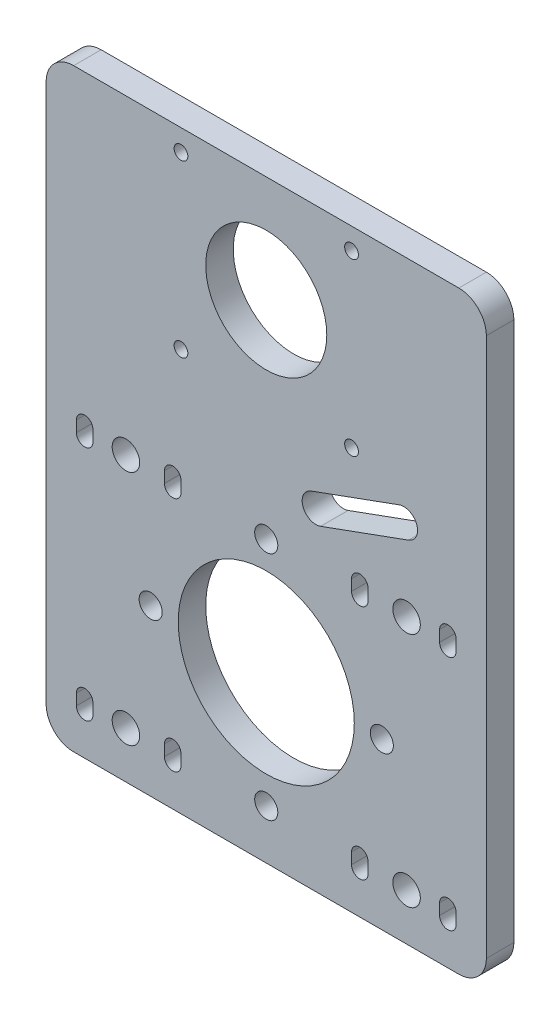
from build123d import *

# Parameters (mm, degrees)
SKETCH1_W           = 80
SKETCH1_H           = 108
SKETCH1_R           = 16
SKETCH1_R_2         = 11
SKETCH1_R_3         = 2.1
SKETCH1_R_4         = 1.25
SKETCH1_R_5         = 2.5
BOSS_EXTRUDE1_DEPTH = 2.5
FILLET1_R           = 5


with BuildPart() as part:
    # Sketch1 → Boss-Extrude1 (new, symmetric)
    with BuildSketch(Plane.XY):
        Rectangle(SKETCH1_W, SKETCH1_H)
        with Locations((0, -24)):
            Circle(SKETCH1_R, mode=Mode.SUBTRACT)
        with Locations((0, 34.6)):
            Circle(SKETCH1_R_2, mode=Mode.SUBTRACT)
        with Locations((21, -24)):
            Circle(SKETCH1_R_3, mode=Mode.SUBTRACT)
        with Locations((-21, -24)):
            Circle(SKETCH1_R_3, mode=Mode.SUBTRACT)
        with Locations((0, -3)):
            Circle(SKETCH1_R_3, mode=Mode.SUBTRACT)
        with Locations((0, -45)):
            Circle(SKETCH1_R_3, mode=Mode.SUBTRACT)
        with Locations((15.5, 50.1)):
            Circle(SKETCH1_R_4, mode=Mode.SUBTRACT)
        with Locations((15.5, 19.1)):
            Circle(SKETCH1_R_4, mode=Mode.SUBTRACT)
        with Locations((-15.5, 19.1)):
            Circle(SKETCH1_R_4, mode=Mode.SUBTRACT)
        with Locations((-15.5, 50.1)):
            Circle(SKETCH1_R_4, mode=Mode.SUBTRACT)
        with Locations((25.5, -45.5)):
            Circle(SKETCH1_R_5, mode=Mode.SUBTRACT)
        with Locations((-25.5, -45.5)):
            Circle(SKETCH1_R_5, mode=Mode.SUBTRACT)
        with Locations((-25.5, -2.5)):
            Circle(SKETCH1_R_5, mode=Mode.SUBTRACT)
        with Locations((25.5, -2.5)):
            Circle(SKETCH1_R_5, mode=Mode.SUBTRACT)
        with BuildLine():
            Line((31.5, -46.5), (31.5, -44.5))
            ThreePointArc((31.5, -44.5), (33, -43), (34.5, -44.5))
            Line((34.5, -44.5), (34.5, -46.5))
            ThreePointArc((34.5, -46.5), (33, -48), (31.5, -46.5))
        make_face(mode=Mode.SUBTRACT)
        with BuildLine():
            Line((-31.5, -46.5), (-31.5, -44.5))
            ThreePointArc((-31.5, -44.5), (-33, -43), (-34.5, -44.5))
            Line((-34.5, -44.5), (-34.5, -46.5))
            ThreePointArc((-34.5, -46.5), (-33, -48), (-31.5, -46.5))
        make_face(mode=Mode.SUBTRACT)
        with BuildLine():
            Line((-15.5, -46.5), (-15.5, -44.5))
            ThreePointArc((-15.5, -44.5), (-17, -43), (-18.5, -44.5))
            Line((-18.5, -44.5), (-18.5, -46.5))
            ThreePointArc((-18.5, -46.5), (-17, -48), (-15.5, -46.5))
        make_face(mode=Mode.SUBTRACT)
        with BuildLine():
            Line((15.5, -46.5), (15.5, -44.5))
            ThreePointArc((15.5, -44.5), (17, -43), (18.5, -44.5))
            Line((18.5, -44.5), (18.5, -46.5))
            ThreePointArc((18.5, -46.5), (17, -48), (15.5, -46.5))
        make_face(mode=Mode.SUBTRACT)
        with BuildLine():
            Line((-31.5, -1.5), (-31.5, -3.5))
            ThreePointArc((-31.5, -3.5), (-33, -5), (-34.5, -3.5))
            Line((-34.5, -3.5), (-34.5, -1.5))
            ThreePointArc((-34.5, -1.5), (-33, 0), (-31.5, -1.5))
        make_face(mode=Mode.SUBTRACT)
        with BuildLine():
            Line((-15.5, -1.5), (-15.5, -3.5))
            ThreePointArc((-15.5, -3.5), (-17, -5), (-18.5, -3.5))
            Line((-18.5, -3.5), (-18.5, -1.5))
            ThreePointArc((-18.5, -1.5), (-17, 0), (-15.5, -1.5))
        make_face(mode=Mode.SUBTRACT)
        with BuildLine():
            Line((31.5, -1.5), (31.5, -3.5))
            ThreePointArc((31.5, -3.5), (33, -5), (34.5, -3.5))
            Line((34.5, -3.5), (34.5, -1.5))
            ThreePointArc((34.5, -1.5), (33, 0), (31.5, -1.5))
        make_face(mode=Mode.SUBTRACT)
        with BuildLine():
            Line((15.5, -1.5), (15.5, -3.5))
            ThreePointArc((15.5, -3.5), (17, -5), (18.5, -3.5))
            Line((18.5, -3.5), (18.5, -1.5))
            ThreePointArc((18.5, -1.5), (17, 0), (15.5, -1.5))
        make_face(mode=Mode.SUBTRACT)
        with BuildLine():
            Line((8.170175088, 8.634889115), (24.144949642, 14.449231552))
            ThreePointArc((24.144949642, 14.449231552), (27.349231552, 12.955050358), (25.855050358, 9.750768448))
            Line((25.855050358, 9.750768448), (9.880275805, 3.936426011))
            ThreePointArc((9.880275805, 3.936426011), (6.675993895, 5.430607205), (8.170175088, 8.634889115))
        make_face(mode=Mode.SUBTRACT)
    extrude(amount=BOSS_EXTRUDE1_DEPTH, both=True)

    # Fillet1
    fillet1_edges = [part.edges().sort_by_distance(p)[0] for p in [
        (40, -54, 0),
        (-40, -54, 0),
        (-40, 54, 0),
        (40, 54, 0),
    ]]
    fillet(fillet1_edges, radius=FILLET1_R)


solid = part.part
